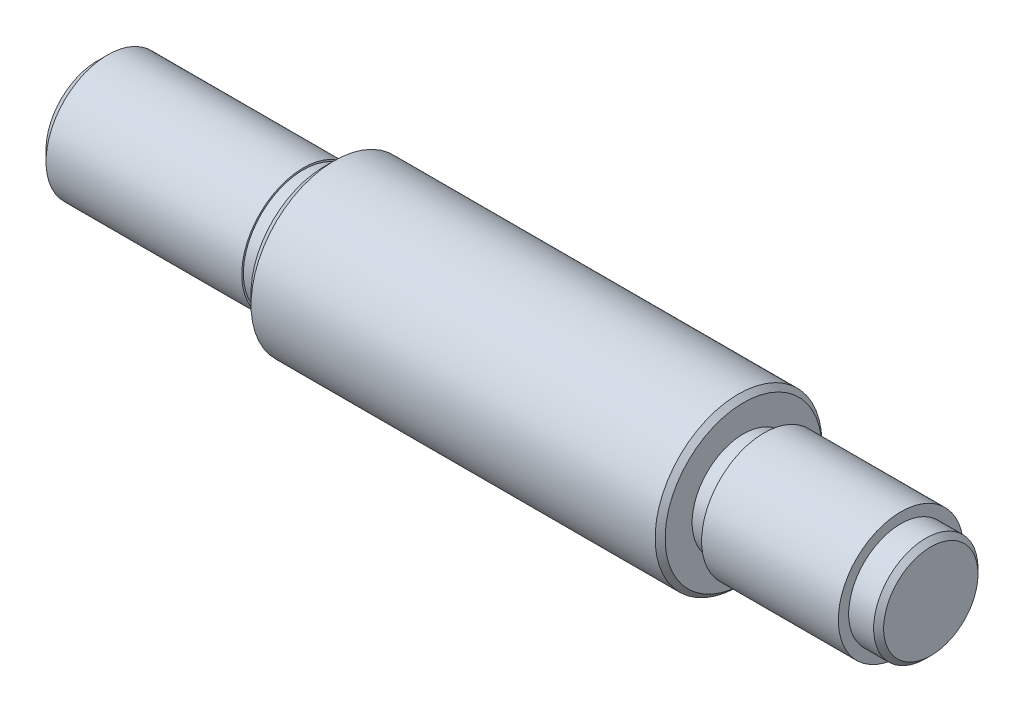
from build123d import *

# Parameters (mm, degrees)
SKETCH1_R           = 3.9116
BOSS_EXTRUDE1_DEPTH = 31.75
SKETCH2_R           = 4.699
BOSS_EXTRUDE2_DEPTH = 17.272
CUT_EXTRUDE1_START  = -1.5748
SKETCH3_R           = 4.699
SKETCH3_R_2         = 4.572
CUT_EXTRUDE1_DEPTH  = 1.5748
SKETCH6_R           = 4.7625
BOSS_EXTRUDE4_DEPTH = 12.7
SKETCH7_R           = 4.7625
SKETCH7_R_2         = 3.9751
CUT_EXTRUDE2_DEPTH  = 2.286
SKETCH8_R           = 6.35
BOSS_EXTRUDE5_DEPTH = 31.9532
CHAMFER1_SIZE       = 0.7874
CHAMFER2_SIZE       = 0.381


with BuildPart() as part:
    # Sketch1 → Boss-Extrude1 (new, symmetric)
    with BuildSketch(Plane(origin=(0, 0, 0), x_dir=(0, 0, -1), z_dir=(1, 0, 0))):
        Circle(SKETCH1_R)
    extrude(amount=BOSS_EXTRUDE1_DEPTH, both=True)

    # Sketch2 → Boss-Extrude2 (add)
    with BuildSketch(Plane.ZY.offset(31.75)):
        Circle(SKETCH2_R)
    extrude(amount=-BOSS_EXTRUDE2_DEPTH)

    # Sketch3 → Cut-Extrude1 (cut)
    with BuildSketch(Plane(origin=(-14.478, 0, 0), x_dir=(0, 0, -1), z_dir=(1, 0, 0)).offset(CUT_EXTRUDE1_START)):
        with Locations(Location((0, 0, 0), (0, 0, 180))):
            Circle(SKETCH3_R)
        Circle(SKETCH3_R_2, mode=Mode.SUBTRACT)
    extrude(amount=CUT_EXTRUDE1_DEPTH, mode=Mode.SUBTRACT)

    # Sketch6 → Boss-Extrude4 (add)
    with BuildSketch(Plane(origin=(31.75, 0, 0), x_dir=(0, 0, -1), z_dir=(1, 0, 0))):
        Circle(SKETCH6_R)
    extrude(amount=-BOSS_EXTRUDE4_DEPTH)

    # Sketch7 → Cut-Extrude2 (cut)
    with BuildSketch(Plane(origin=(31.75, 0, 0), x_dir=(0, 0, -1), z_dir=(1, 0, 0))):
        Circle(SKETCH7_R)
        Circle(SKETCH7_R_2, mode=Mode.SUBTRACT)
    extrude(amount=-CUT_EXTRUDE2_DEPTH, mode=Mode.SUBTRACT)

    # Sketch8 → Boss-Extrude5 (add)
    with BuildSketch(Plane(origin=(-14.478, 0, 0), x_dir=(0, 0, -1), z_dir=(1, 0, 0))):
        Circle(SKETCH8_R)
    extrude(amount=BOSS_EXTRUDE5_DEPTH)

    # Chamfer1
    chamfer1_edges = [part.edges().sort_by_distance(p)[0] for p in [
        (-14.478, 0, 6.35),
        (-31.75, 0, -4.699),
    ]]
    chamfer(chamfer1_edges, length=CHAMFER1_SIZE)

    # Chamfer2
    chamfer2_edges = [part.edges().sort_by_distance(p)[0] for p in [
        (31.75, 0, 3.9751),
        (17.4752, 0, 6.35),
    ]]
    chamfer(chamfer2_edges, length=CHAMFER2_SIZE)


solid = part.part
